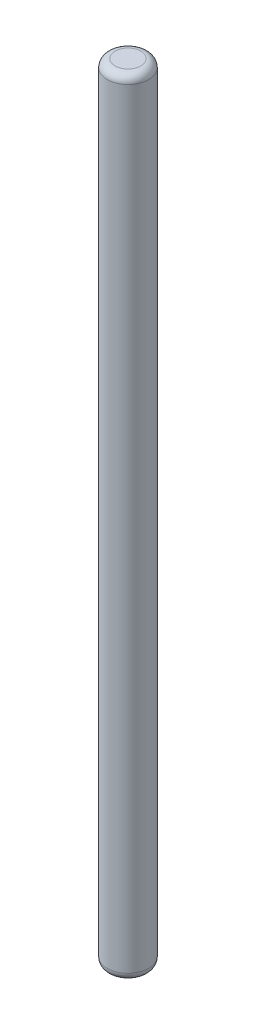
from build123d import *

# Parameters (mm, degrees)
SKETCH1_R           = 1.0033
BOSS_EXTRUDE1_DEPTH = 37.9984
FILLET1_R           = 0.381


with BuildPart() as part:
    # Sketch1 → Boss-Extrude1 (new body)
    with BuildSketch(Plane(origin=(0, 0, 0), x_dir=(1, 0, 0), z_dir=(0, 1, 0))):
        with Locations(Location((0, 0, 0), (0, 0, 270))):
            Circle(SKETCH1_R)
    extrude(amount=BOSS_EXTRUDE1_DEPTH)

    # Fillet1
    fillet1_edges = [part.edges().sort_by_distance(p)[0] for p in [
        (0, 0, -1.0033),
        (0, 37.9984, -1.0033),
    ]]
    fillet(fillet1_edges, radius=FILLET1_R)


solid = part.part
